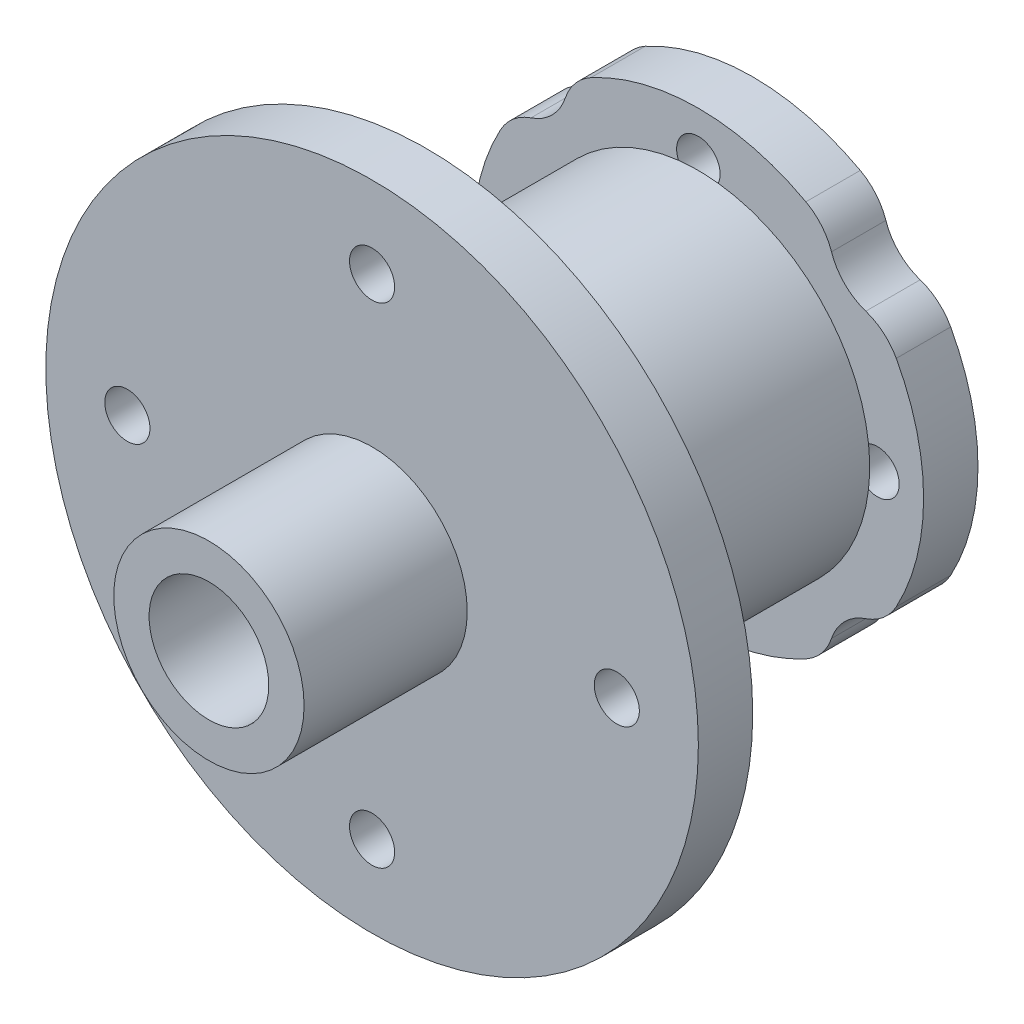
from build123d import *

# Parameters (mm, degrees)
SKETCH1_W           = 50
SKETCH1_H           = 50
SKETCH1_R           = 4
BOSS_EXTRUDE1_DEPTH = 10
FILLET1_R           = 10
FILLET2_R           = 10
SKETCH2_R           = 31.5
BOSS_EXTRUDE2_DEPTH = 50
SKETCH3_R           = 60
SKETCH3_R_2         = 4.15
BOSS_EXTRUDE3_DEPTH = 10
SKETCH4_R           = 17.5
SKETCH4_R_2         = 11
BOSS_EXTRUDE4_DEPTH = 30


with BuildPart() as part:
    # Sketch1 → Boss-Extrude1 (new body)
    # profile 1 of 5: a face of its own
    with BuildSketch(Plane.XY):
        Rectangle(SKETCH1_W, SKETCH1_H)
    # profile 2 of 5: a face of its own
    with BuildSketch(Plane.XY):
        with BuildLine():
            Line((-25, -25), (-25, 25))
            Line((-25, 25), (-33.024481828, 25))
            ThreePointArc((-33.024481828, 25), (-41.42, 0), (-33.024481828, -25))
            Line((-33.024481828, -25), (-25, -25))
        make_face()
        with Locations((-32.935, 0)):
            Circle(SKETCH1_R, mode=Mode.SUBTRACT)
    # profile 3 of 5: a face of its own
    with BuildSketch(Plane.XY):
        with BuildLine():
            Line((25, 25), (25, 33.024481828))
            ThreePointArc((25, 33.024481828), (0, 41.42), (-25, 33.024481828))
            Line((-25, 33.024481828), (-25, 25))
            Line((-25, 25), (25, 25))
        make_face()
        with Locations((0, 32.935)):
            Circle(SKETCH1_R, mode=Mode.SUBTRACT)
    # profile 4 of 5: a face of its own
    with BuildSketch(Plane.XY):
        with BuildLine():
            Line((33.024481828, 25), (25, 25))
            Line((25, 25), (25, -25))
            Line((25, -25), (33.024481828, -25))
            ThreePointArc((33.024481828, -25), (41.42, 0), (33.024481828, 25))
        make_face()
        with Locations((32.935, 0)):
            Circle(SKETCH1_R, mode=Mode.SUBTRACT)
    # profile 5 of 5: a face of its own
    with BuildSketch(Plane.XY):
        with BuildLine():
            Line((25, -33.024481828), (25, -25))
            Line((25, -25), (-25, -25))
            Line((-25, -25), (-25, -33.024481828))
            ThreePointArc((-25, -33.024481828), (0, -41.42), (25, -33.024481828))
        make_face()
        with Locations((0, -32.935)):
            Circle(SKETCH1_R, mode=Mode.SUBTRACT)
    extrude(amount=BOSS_EXTRUDE1_DEPTH)

    # Fillet1
    fillet1_edges = [part.edges().sort_by_distance(p)[0] for p in [
        (-25, 33.024481828, 5),
        (25, 33.024481828, 5),
        (33.024481828, 25, 5),
        (33.024481828, -25, 5),
        (25, -33.024481828, 5),
        (-25, -33.024481828, 5),
        (-33.024481828, -25, 5),
        (-33.024481828, 25, 5),
    ]]
    fillet(fillet1_edges, radius=FILLET1_R)

    # Fillet2
    fillet2_edges = [part.edges().sort_by_distance(p)[0] for p in [
        (25, 25, 5),
        (-25, 25, 5),
        (-25, -25, 5),
        (25, -25, 5),
    ]]
    fillet(fillet2_edges, radius=FILLET2_R)

    # Sketch2 → Boss-Extrude2 (add)
    with BuildSketch(Plane.XY.offset(10)):
        with Locations(Location((0, 0, 0), (0, 0, 173.354533999))):
            Circle(SKETCH2_R)
    extrude(amount=BOSS_EXTRUDE2_DEPTH)

    # Sketch3 → Boss-Extrude3 (add)
    with BuildSketch(Plane.XY.offset(60)):
        Circle(SKETCH3_R)
        with Locations((0, 45)):
            Circle(SKETCH3_R_2, mode=Mode.SUBTRACT)
        with Locations((45, 0)):
            Circle(SKETCH3_R_2, mode=Mode.SUBTRACT)
        with Locations((0, -45)):
            Circle(SKETCH3_R_2, mode=Mode.SUBTRACT)
        with Locations((-45, 0)):
            Circle(SKETCH3_R_2, mode=Mode.SUBTRACT)
    extrude(amount=BOSS_EXTRUDE3_DEPTH)

    # Sketch4 → Boss-Extrude4 (add)
    with BuildSketch(Plane.XY.offset(70)):
        Circle(SKETCH4_R)
        Circle(SKETCH4_R_2, mode=Mode.SUBTRACT)
    extrude(amount=BOSS_EXTRUDE4_DEPTH)


solid = part.part
